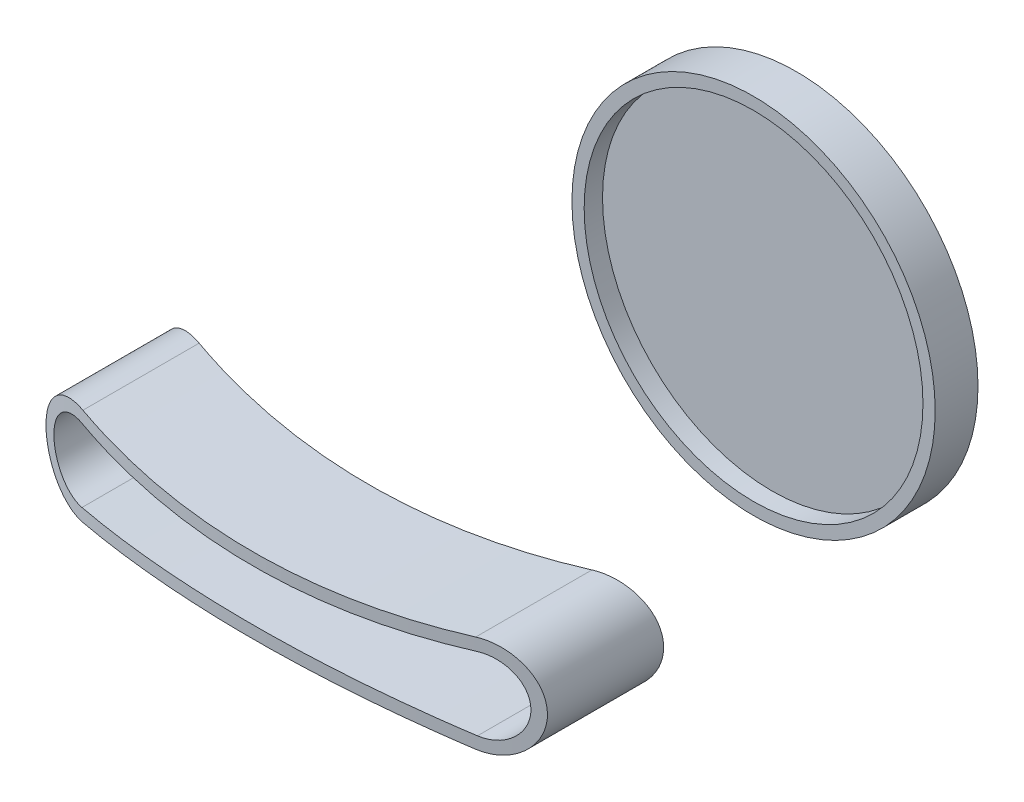
from build123d import *

# Parameters (mm, degrees)
SKETCH1_R           = 29.7
BOSS_EXTRUDE1_DEPTH = 7
BOSS_EXTRUDE2_DEPTH = 20
CUT_EXTRUDE1_DEPTH  = 20
SKETCH4_R           = 27.7
CUT_EXTRUDE2_DEPTH  = 3


with BuildPart() as part:
    # Sketch1 → Boss-Extrude1 (new body)
    with BuildSketch(Plane.XY):
        Circle(SKETCH1_R)
    extrude(amount=BOSS_EXTRUDE1_DEPTH)

    # Sketch4 → Cut-Extrude2 (cut)
    with BuildSketch(Plane.XY.offset(7)):
        Circle(SKETCH4_R)
    extrude(amount=-CUT_EXTRUDE2_DEPTH, mode=Mode.SUBTRACT)


with BuildPart() as body_2:
    # Sketch2 → Boss-Extrude2 (new, symmetric)
    with BuildSketch(Plane.XY.offset(82.7)):
        with BuildLine():
            ThreePointArc((32.11409396, -7.950796846), (41, 0), (32.11409396, 7.950796846))
            ThreePointArc((32.11409396, 7.950796846), (0, 6.167182517), (-32.11409396, 7.950796846))
            ThreePointArc((-32.11409396, 7.950796846), (-41, 0), (-32.11409396, -7.950796846))
            ThreePointArc((-32.11409396, -7.950796846), (0, -6.167182517), (32.11409396, -7.950796846))
        make_face()
        with BuildLine():
            ThreePointArc((-32.33557047, 5.963097635), (0, 4.167182517), (32.33557047, 5.963097635))
            ThreePointArc((32.33557047, 5.963097635), (39, 0), (32.33557047, -5.963097635))
            ThreePointArc((32.33557047, -5.963097635), (0, -4.167182517), (-32.33557047, -5.963097635))
            ThreePointArc((-32.33557047, -5.963097635), (-39, 0), (-32.33557047, 5.963097635))
        make_face(mode=Mode.SUBTRACT)
    extrude(amount=BOSS_EXTRUDE2_DEPTH, both=True)

    # Sketch3 → Cut-Extrude1 (cut, symmetric)
    with BuildSketch(Plane(origin=(0, 0, 0), x_dir=(1, 0, 0), z_dir=(0, 1, 0))):
        with BuildLine():
            ThreePointArc((-41, -81.7), (0, -88.921455941), (41, -81.7))
            Line((41, -81.7), (103.064038999, -103.38833583))
            Line((103.064038999, -103.38833583), (16.872750213, -172.184638386))
            Line((16.872750213, -172.184638386), (-81.449068681, -125.07667166))
            Line((-81.449068681, -125.07667166), (-41, -81.7))
        make_face()
        with BuildLine():
            Line((-41, -62.7), (13.340762668, -29.679350995))
            Line((13.340762668, -29.679350995), (58.396937956, -46.189675497))
            Line((58.396937956, -46.189675497), (41, -62.7))
            ThreePointArc((41, -62.7), (0, -69.921455941), (-41, -62.7))
        make_face()
    extrude(amount=CUT_EXTRUDE1_DEPTH, both=True, mode=Mode.SUBTRACT)


solid = Compound([part.part, body_2.part])
